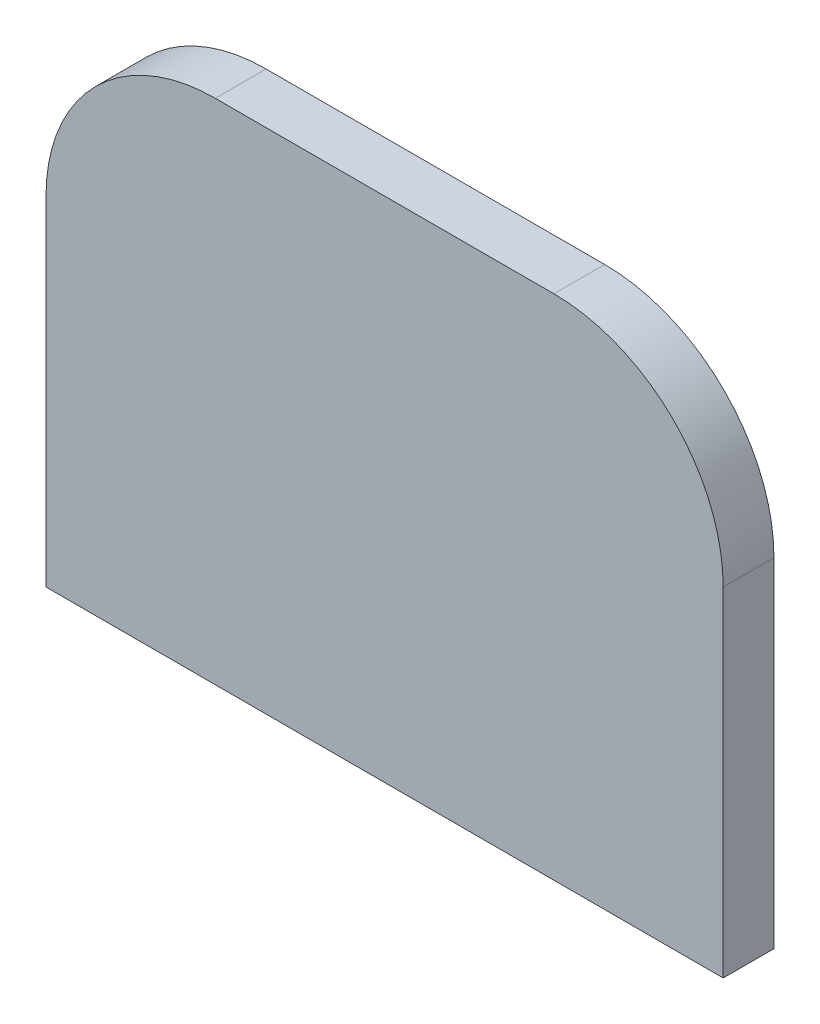
from build123d import *

# Parameters (mm, degrees)
SKETCH1_W           = 40
SKETCH1_H           = 30
BOSS_EXTRUDE1_DEPTH = 3
FILLET1_R           = 10


with BuildPart() as part:
    # Sketch1 → Boss-Extrude1 (new body)
    with BuildSketch(Plane.XY):
        Rectangle(SKETCH1_W, SKETCH1_H)
    extrude(amount=BOSS_EXTRUDE1_DEPTH)

    # Fillet1
    fillet1_edges = [part.edges().sort_by_distance(p)[0] for p in [
        (-20, 15, 1.5),
        (20, 15, 1.5),
    ]]
    fillet(fillet1_edges, radius=FILLET1_R)


solid = part.part
